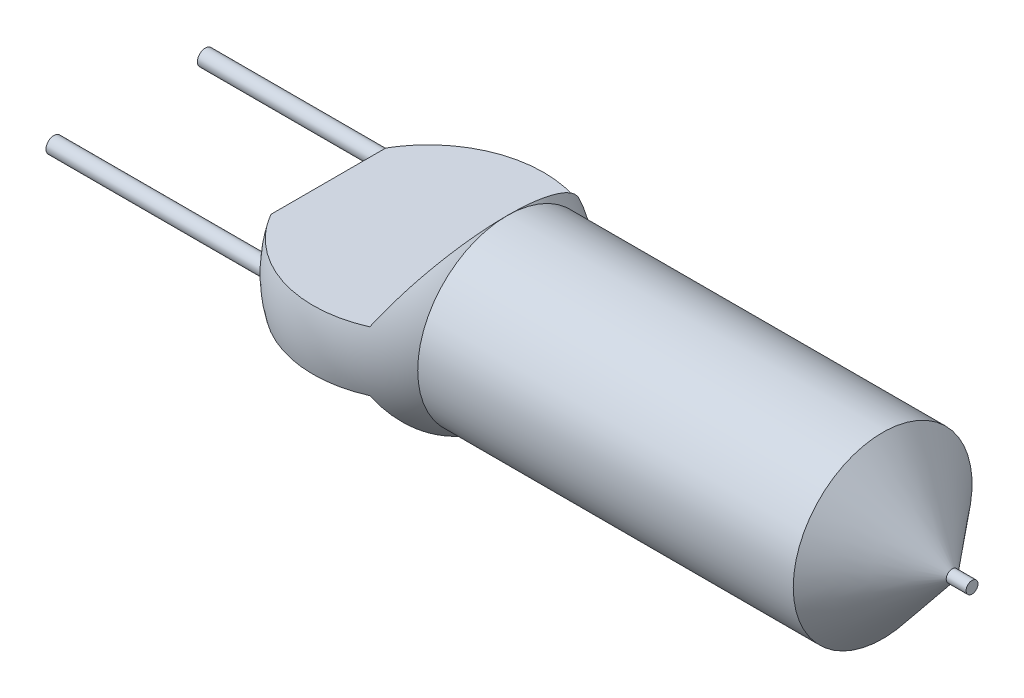
from build123d import *

# Parameters (mm, degrees)
CUT_EXTRUDE_1_DEPTH      = 10
CUT_EXTRUDE_1_DEPTH_BACK = 10
EXTRUDE_1_DEPTH          = 10
EXTRUDE_1_DEPTH_BACK     = 4
SKETCH_2_R               = 0.4
EXTRUDE_1_2_DEPTH        = 10
EXTRUDE_1_2_DEPTH_BACK   = 4


with BuildPart() as part:
    # 草图1 → 旋转1 (revolve)
    with BuildSketch(Plane.XY):
        with BuildLine():
            Line((0, 0), (0, 3.25))
            ThreePointArc((0, 3.25), (4.213404617, 5.93848676), (9, 4.5))
            Line((9, 4.5), (27.9, 4.5))
            Line((27.9, 4.5), (31.4, 0.3))
            Line((31.4, 0.3), (32.4, 0.3))
            Line((32.4, 0.3), (32.4, 0))
            Line((32.4, 0), (0, 0))
        make_face()
    revolve(axis=Axis((-53.438104907, 0, 0), (1, 0, 0)))

    # 草图3 → 切除-拉伸1 (cut, two sides: drawn at the far end of the back side and taken through both)
    with BuildSketch(Plane.XY.offset(-CUT_EXTRUDE_1_DEPTH_BACK)):
        Polygon((9, 4.5), (7.391565763, 1.5), (-2.815334695, 1.5), (-2.815334695, 8.903303641), (9, 8.903303641), align=None)
        Polygon((9, -8.903303641), (9, -4.5), (7.391565763, -1.5), (-2.815334695, -1.5), (-2.815334695, -8.903303641), align=None)
    extrude(amount=CUT_EXTRUDE_1_DEPTH + CUT_EXTRUDE_1_DEPTH_BACK, mode=Mode.SUBTRACT)


with BuildPart() as body_2:
    # 草图2 → 凸台-拉伸1 (new, two sides: drawn at the far end of the back side and taken through both)
    with BuildSketch(Plane.ZY.offset(-EXTRUDE_1_DEPTH_BACK)):
        with Locations((-3.81, 0)):
            Circle(SKETCH_2_R)
    extrude(amount=EXTRUDE_1_DEPTH + EXTRUDE_1_DEPTH_BACK)


with BuildPart() as body_3:
    # 草图2 → Extrude 1 2 (new, two sides: drawn at the far end of the back side and taken through both)
    with BuildSketch(Plane.ZY.offset(-EXTRUDE_1_2_DEPTH_BACK)):
        with Locations((3.81, 0)):
            Circle(SKETCH_2_R)
    extrude(amount=EXTRUDE_1_2_DEPTH + EXTRUDE_1_2_DEPTH_BACK)


solid = Compound([part.part, body_2.part, body_3.part])
